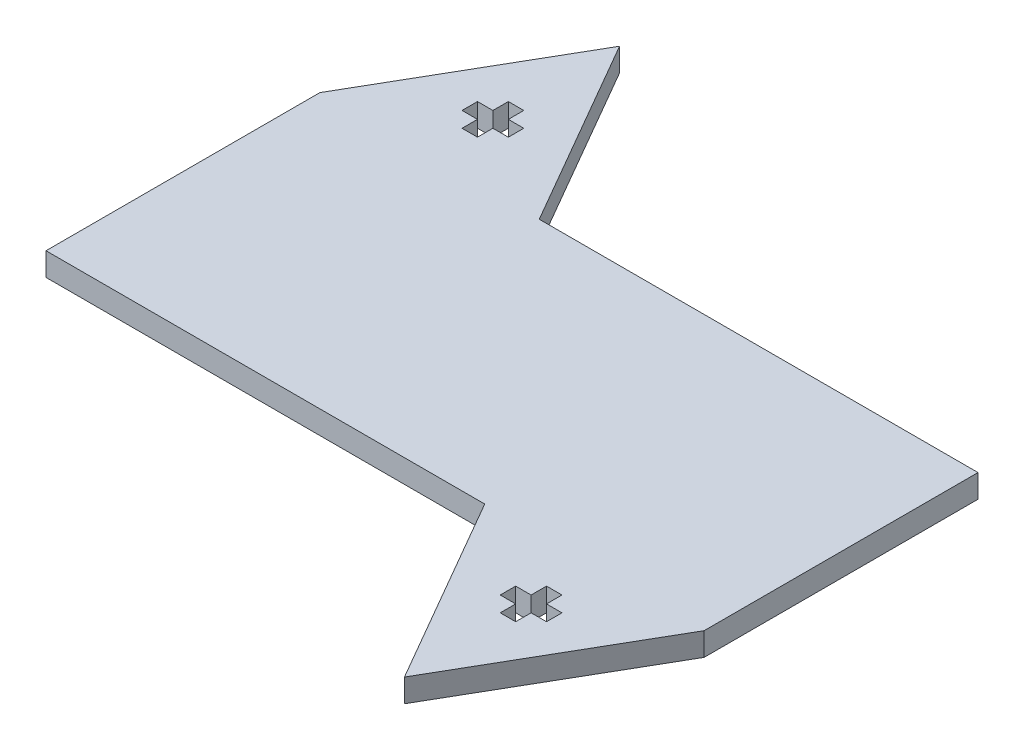
from build123d import *

# Parameters (mm, degrees)
BOSS_EXTRUDE1_DEPTH = 7.62


with BuildPart() as part:
    # Sketch1 → Boss-Extrude1 (new body)
    with BuildSketch(Plane(origin=(0, 0, 0), x_dir=(1, 0, 0), z_dir=(0, 1, 0))):
        Polygon((-108.230047059, 57.852952941), (36.189952941, 57.852952941), (36.189952941, -32.306887059), (0.084952941, -94.842581466), (-36.020047059, -32.306887059), (-180.440047059, -32.306887059), (-180.440047059, 57.852952941), (-144.335047059, 120.388647348), align=None)
        Polygon((7.704952941, -50.611397059), (7.704952941, -55.691397059), (2.624952941, -55.691397059), (2.624952941, -60.771397059), (-2.455047059, -60.771397059), (-2.455047059, -55.691397059), (-7.535047059, -55.691397059), (-7.535047059, -50.611397059), (-2.455047059, -50.611397059), (-2.455047059, -45.531397059), (2.624952941, -45.531397059), (2.624952941, -50.611397059), align=None, mode=Mode.SUBTRACT)
        Polygon((-146.875047059, 81.237462941), (-151.955047059, 81.237462941), (-151.955047059, 76.157462941), (-146.875047059, 76.157462941), (-146.875047059, 71.077462941), (-141.795047059, 71.077462941), (-141.795047059, 76.157462941), (-136.715047059, 76.157462941), (-136.715047059, 81.237462941), (-141.795047059, 81.237462941), (-141.795047059, 86.317462941), (-146.875047059, 86.317462941), align=None, mode=Mode.SUBTRACT)
    extrude(amount=BOSS_EXTRUDE1_DEPTH)


solid = part.part
